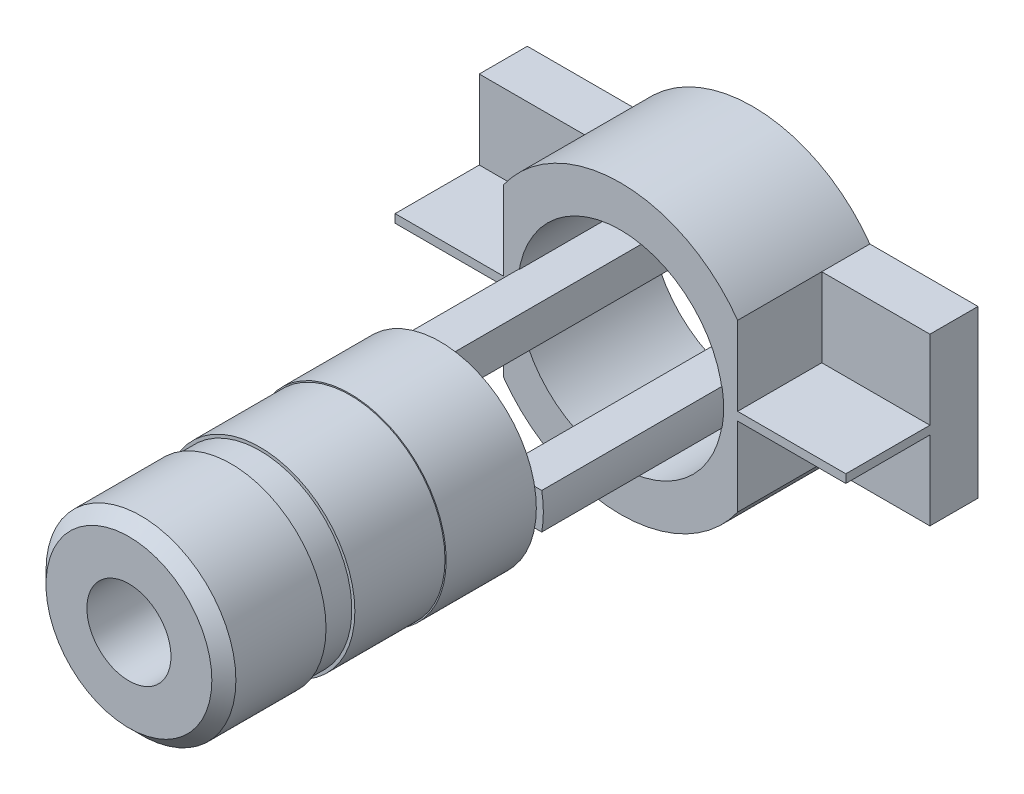
from build123d import *

# Parameters (mm, degrees)
SKETCH1_R             = 7.9
SKETCH1_R_2           = 3.5
BOSS_EXTRUDE1_DEPTH   = 18.4
CHAMFER1_SIZE         = 1
CUT_EXTRUDE6_START    = 2.4
SKETCH19_R            = 7.9
SKETCH19_R_2          = 7.65
CUT_EXTRUDE6_DEPTH    = 2.4
SKETCH24_R            = 8
BOSS_EXTRUDE5_DEPTH   = 7.5
BOSS_EXTRUDE6_DEPTH   = 26
BOSS_EXTRUDE6_2_DEPTH = 26
SKETCH26_R            = 11.95
SKETCH26_R_2          = 8.55
BOSS_EXTRUDE7_DEPTH   = 11
CUT_EXTRUDE9_DEPTH    = 45.253982872
SKETCH28_R            = 3.5
CUT_EXTRUDE10_DEPTH   = 31.230200132
SKETCH29_W            = 4
SKETCH29_H            = 13.818827736
BOSS_EXTRUDE8_DEPTH   = 9
SKETCH30_W            = 4
SKETCH30_H            = 13.818827736
BOSS_EXTRUDE9_DEPTH   = 9
BOSS_EXTRUDE10_DEPTH  = 9
BOSS_EXTRUDE11_DEPTH  = 9


with BuildPart() as part:
    # Sketch1 → Boss-Extrude1 (new body)
    with BuildSketch(Plane.XY):
        Circle(SKETCH1_R)
        Circle(SKETCH1_R_2, mode=Mode.SUBTRACT)
    extrude(amount=BOSS_EXTRUDE1_DEPTH)

    # Chamfer1
    chamfer1_edges = [part.edges().sort_by_distance(p)[0] for p in [
        (-7.9, 0, 18.4),
    ]]
    chamfer(chamfer1_edges, length=CHAMFER1_SIZE)

    # Sketch19 → Cut-Extrude6 (cut)
    with BuildSketch(Plane(origin=(0, 0, 9.9), x_dir=(-1, 0, 0), z_dir=(0, 0, -1)).offset(CUT_EXTRUDE6_START)):
        Circle(SKETCH19_R)
        Circle(SKETCH19_R_2, mode=Mode.SUBTRACT)
    extrude(amount=-CUT_EXTRUDE6_DEPTH, mode=Mode.SUBTRACT)


with BuildPart() as body_2:
    # Sketch24 → Boss-Extrude5 (new body)
    with BuildSketch(Plane(origin=(0, 0, 0), x_dir=(-1, 0, 0), z_dir=(0, 0, -1))):
        Circle(SKETCH24_R)
    extrude(amount=BOSS_EXTRUDE5_DEPTH)

    # Sketch28 → Cut-Extrude10 (cut, through all)
    with BuildSketch(Plane(origin=(0, 0, -7.5), x_dir=(-1, 0, 0), z_dir=(0, 0, -1))):
        Circle(SKETCH28_R)
    extrude(amount=-CUT_EXTRUDE10_DEPTH, mode=Mode.SUBTRACT)


with BuildPart() as body_3:
    # Sketch25 → Boss-Extrude6 (new body)
    with BuildSketch(Plane(origin=(0, 0, -7.5), x_dir=(-1, 0, 0), z_dir=(0, 0, -1))):
        with BuildLine():
            Line((-5.15, 1.5), (-8.45, 1.5))
            ThreePointArc((-8.45, 1.5), (-8.549984118, 0.752960074), (-8.583399735, 0))
            ThreePointArc((-8.583399735, 0), (-8.549984118, -0.752960074), (-8.45, -1.5))
            Line((-8.45, -1.5), (-5.15, -1.5))
            Line((-5.15, -1.5), (-5.15, 0))
            Line((-5.15, 0), (-5.15, 1.5))
        make_face()
    extrude(amount=BOSS_EXTRUDE6_DEPTH)


with BuildPart() as body_4:
    # Sketch25 → Boss-Extrude6 2 (new body)
    with BuildSketch(Plane(origin=(0, 0, -7.5), x_dir=(-1, 0, 0), z_dir=(0, 0, -1))):
        with BuildLine():
            Line((5.15, 1.5), (5.15, 0))
            Line((5.15, 0), (5.15, -1.5))
            Line((5.15, -1.5), (8.45, -1.5))
            ThreePointArc((8.45, -1.5), (8.549984118, -0.752960074), (8.583399735, 0))
            ThreePointArc((8.583399735, 0), (8.549984118, 0.752960074), (8.45, 1.5))
            Line((8.45, 1.5), (5.15, 1.5))
        make_face()
    extrude(amount=BOSS_EXTRUDE6_2_DEPTH)


with BuildPart() as body_5:
    # Sketch26 → Boss-Extrude7 (new body)
    with BuildSketch(Plane(origin=(0, 0, -33.5), x_dir=(-1, 0, 0), z_dir=(0, 0, -1))):
        Circle(SKETCH26_R)
        Circle(SKETCH26_R_2, mode=Mode.SUBTRACT)
    extrude(amount=-BOSS_EXTRUDE7_DEPTH)

    # Sketch27 → Cut-Extrude9 (cut, through all)
    with BuildSketch(Plane.XY.offset(-22.5)):
        with BuildLine():
            Line((-9.75, 0), (-9.75, 6.909413868))
            ThreePointArc((-9.75, 6.909413868), (-11.95, 0), (-9.75, -6.909413868))
            Line((-9.75, -6.909413868), (-9.75, 0))
        make_face()
        with BuildLine():
            Line((9.75, 0), (9.75, 6.909413868))
            ThreePointArc((9.75, 6.909413868), (11.95, 0), (9.75, -6.909413868))
            Line((9.75, -6.909413868), (9.75, 0))
        make_face()
    extrude(amount=-CUT_EXTRUDE9_DEPTH, mode=Mode.SUBTRACT)

    # Sketch29 → Boss-Extrude8 (add)
    with BuildSketch(Plane.ZY.offset(9.75)):
        with Locations((-31.5, 0)):
            Rectangle(SKETCH29_W, SKETCH29_H)
    extrude(amount=BOSS_EXTRUDE8_DEPTH)

    # Sketch30 → Boss-Extrude9 (add)
    with BuildSketch(Plane(origin=(9.75, 0, 0), x_dir=(0, 0, -1), z_dir=(1, 0, 0))):
        with Locations((31.5, 0)):
            Rectangle(SKETCH30_W, SKETCH30_H)
    extrude(amount=BOSS_EXTRUDE9_DEPTH)

    # Sketch31 → Boss-Extrude10 (add)
    with BuildSketch(Plane(origin=(9.75, 0, 0), x_dir=(0, 0, -1), z_dir=(1, 0, 0))):
        Polygon((22.5, 0), (22.5, 0.35), (29.5, 0.35), (29.5, -0.35), (22.5, -0.35), align=None)
    extrude(amount=BOSS_EXTRUDE10_DEPTH)

    # Sketch32 → Boss-Extrude11 (add)
    with BuildSketch(Plane.ZY.offset(9.75)):
        Polygon((-22.5, 0), (-22.5, 0.35), (-29.5, 0.35), (-29.5, -0.35), (-22.5, -0.35), align=None)
    extrude(amount=BOSS_EXTRUDE11_DEPTH)


solid = Compound([part.part, body_2.part, body_3.part, body_4.part, body_5.part])
